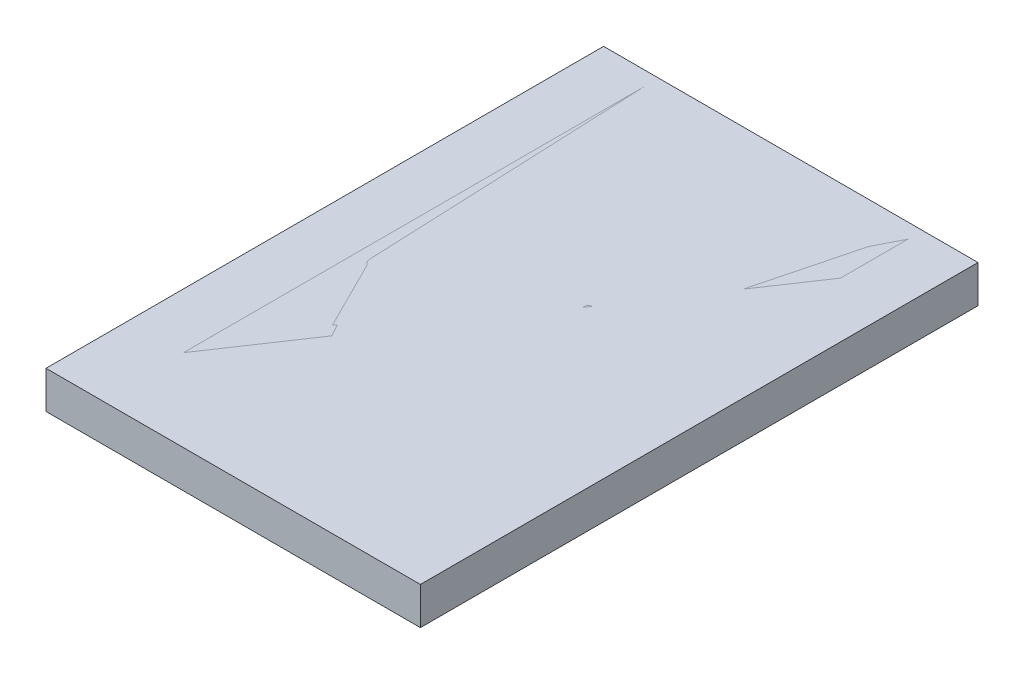
from build123d import *

# Parameters (mm, degrees)
SKETCH1_W           = 56.4
SKETCH1_H           = 112.8
BOSS_EXTRUDE1_DEPTH = 8
SKETCH2_R           = 19.25
CUT_EXTRUDE1_DEPTH  = 2
SKETCH3_R           = 5
CUT_EXTRUDE2_DEPTH  = 127.256881001
SKETCH4_R           = 2
CUT_EXTRUDE3_DEPTH  = 127.367717396
SKETCH5_R           = 14
CUT_EXTRUDE4_DEPTH  = 127.367717396
SKETCH6_W           = 80
SKETCH6_H           = 119.15
BOSS_EXTRUDE2_DEPTH = 8
SKETCH9_W           = 29
SKETCH9_H           = 4
CUT_EXTRUDE5_DEPTH  = 3


with BuildPart() as part:
    # Sketch1 → Boss-Extrude1 (new body)
    with BuildSketch(Plane(origin=(0, 0, 0), x_dir=(1, 0, 0), z_dir=(0, 1, 0))):
        with Locations((28.2, -56.4)):
            Rectangle(SKETCH1_W, SKETCH1_H)
    extrude(amount=BOSS_EXTRUDE1_DEPTH)

    # Sketch2 → Cut-Extrude1 (cut)
    with BuildSketch(Plane(origin=(0, 8, 0), x_dir=(1, 0, 0), z_dir=(0, 1, 0))):
        with Locations((28.2, -28.2)):
            Circle(SKETCH2_R)
    extrude(amount=-CUT_EXTRUDE1_DEPTH, mode=Mode.SUBTRACT)

    # Sketch3 → Cut-Extrude2 (cut, through all)
    with BuildSketch(Plane(origin=(0, 6, 0), x_dir=(1, 0, 0), z_dir=(0, 1, 0))):
        with Locations((28.2, -28.2)):
            Circle(SKETCH3_R)
    extrude(amount=-CUT_EXTRUDE2_DEPTH, mode=Mode.SUBTRACT)

    # Sketch4 → Cut-Extrude3 (cut, through all)
    with BuildSketch(Plane(origin=(0, 8, 0), x_dir=(1, 0, 0), z_dir=(0, 1, 0))):
        with Locations((4.58, -4.58)):
            Circle(SKETCH4_R)
        with Locations((51.82, -4.58)):
            Circle(SKETCH4_R)
        with Locations((51.82, -51.82)):
            Circle(SKETCH4_R)
        with Locations((4.58, -51.82)):
            Circle(SKETCH4_R)
    cut_extrude3 = extrude(amount=-CUT_EXTRUDE3_DEPTH, mode=Mode.SUBTRACT)

    # Sketch5 → Cut-Extrude4 (cut, through all)
    with BuildSketch(Plane(origin=(0, 8, 0), x_dir=(1, 0, 0), z_dir=(0, 1, 0))):
        with Locations((28.2, -84.6)):
            Circle(SKETCH5_R)
    extrude(amount=-CUT_EXTRUDE4_DEPTH, mode=Mode.SUBTRACT)

    # Mirror1: Cut-Extrude3 across plane
    add(cut_extrude3.mirror(Plane.XY.offset(56.4)), mode=Mode.SUBTRACT)

    # Sketch9 → Cut-Extrude5 (cut)
    with BuildSketch(Plane.XZ):
        with Locations((42.7, 56.4)):
            Rectangle(SKETCH9_W, SKETCH9_H)
    extrude(amount=-CUT_EXTRUDE5_DEPTH, mode=Mode.SUBTRACT)


with BuildPart() as body_2:
    # Sketch6 → Boss-Extrude2 (new body)
    with BuildSketch(Plane(origin=(0, 8, 0), x_dir=(1, 0, 0), z_dir=(0, 1, 0))):
        with Locations((28.2, -56.4)):
            Rectangle(SKETCH6_W, SKETCH6_H)
    extrude(amount=-BOSS_EXTRUDE2_DEPTH)


solid = Compound([part.part, body_2.part])
